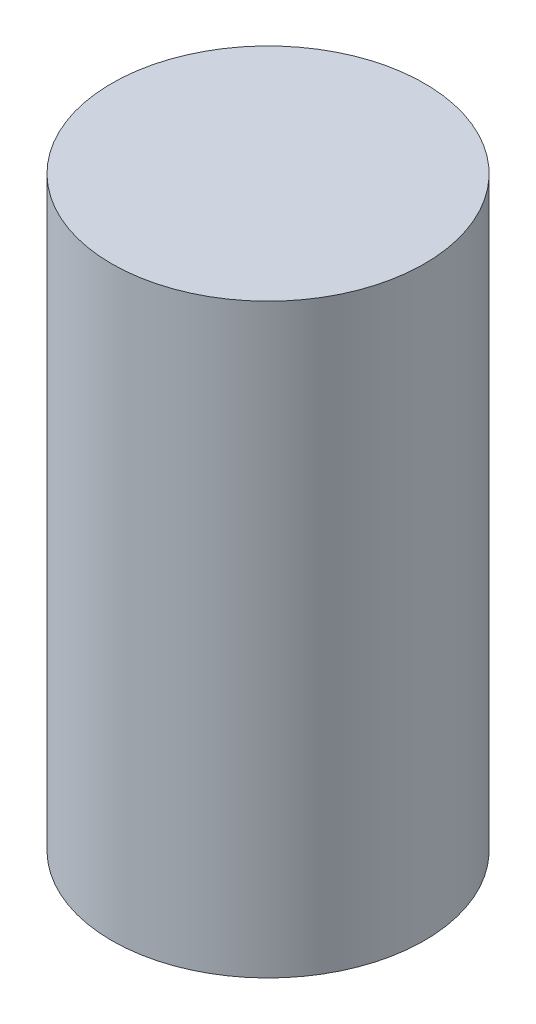
from build123d import *

# Parameters (mm, degrees)
SKETCH1_R           = 69.85
BOSS_EXTRUDE1_DEPTH = 261.874


with BuildPart() as part:
    # Sketch1 → Boss-Extrude1 (new body)
    with BuildSketch(Plane(origin=(0, 0, 0), x_dir=(1, 0, 0), z_dir=(0, 1, 0))):
        with Locations(Location((0, 0, 0), (0, 0, 270))):
            Circle(SKETCH1_R)
    extrude(amount=BOSS_EXTRUDE1_DEPTH)


solid = part.part
